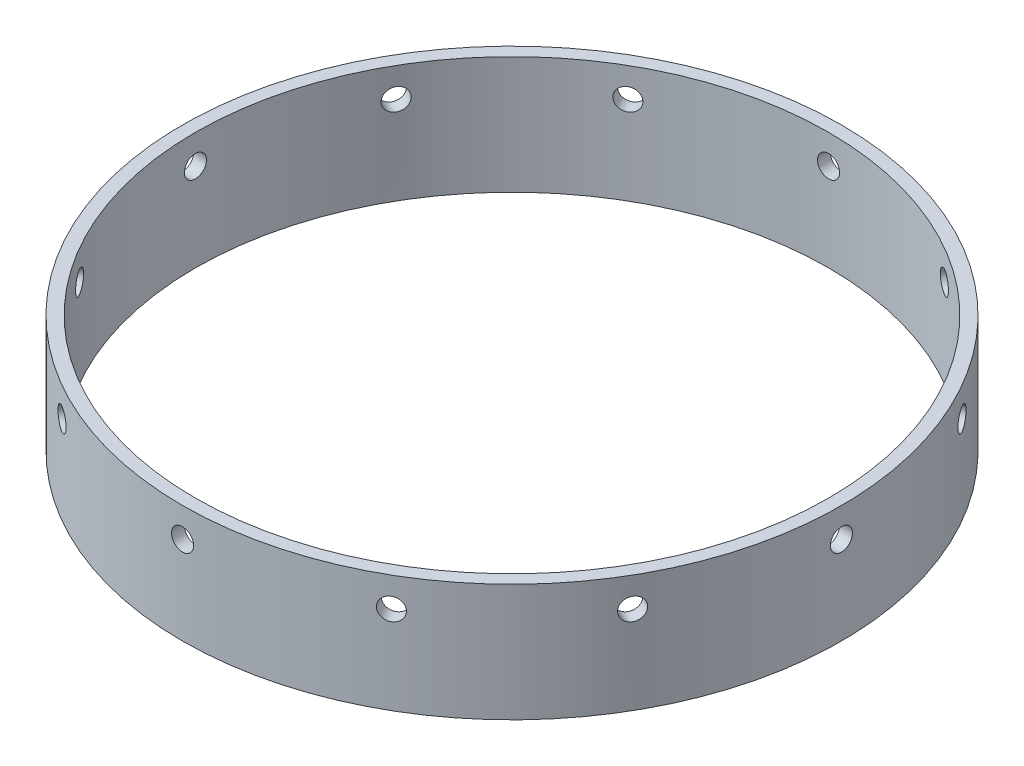
from build123d import *

# Parameters (mm, degrees)
SKETCH_1_R               = 44.9
SKETCH_1_R_2             = 2.5
SKETCH_1_R_3             = 18.4
EXTRUDE_1_DEPTH          = 16
SKETCH_2_R               = 4
CUT_EXTRUDE_1_DEPTH      = 3
SKETCH_4_R               = 4.5
CUT_EXTRUDE_2_DEPTH      = 5.1
SKETCH_5_R               = 1.5
CUT_EXTRUDE_3_DEPTH      = 10
PATTERN_CIRCULAR_1_COUNT = 12
FILLET_1_R               = 0.5
SKETCH1_R                = 43.15
CUT_EXTRUDE1_DEPTH       = 66.482975056


with BuildPart() as part:
    # 草图1 → 凸台-拉伸1 (new body)
    with BuildSketch(Plane(origin=(0, 0, 0), x_dir=(1, 0, 0), z_dir=(0, 1, 0))):
        with Locations(Location((0, 0, 0), (0, 0, 270))):
            Circle(SKETCH_1_R)
        with Locations(Location((-24.6, 0, 0), (0, 0, 270))):
            Circle(SKETCH_1_R_2, mode=Mode.SUBTRACT)
        with Locations(Location((-12.3, 21.304224933, 0), (0, 0, 270))):
            Circle(SKETCH_1_R_2, mode=Mode.SUBTRACT)
        with Locations(Location((12.3, 21.304224933, 0), (0, 0, 270))):
            Circle(SKETCH_1_R_2, mode=Mode.SUBTRACT)
        with Locations(Location((24.6, 0, 0), (0, 0, 270))):
            Circle(SKETCH_1_R_2, mode=Mode.SUBTRACT)
        with Locations(Location((12.3, -21.304224933, 0), (0, 0, 270))):
            Circle(SKETCH_1_R_2, mode=Mode.SUBTRACT)
        with Locations(Location((-12.3, -21.304224933, 0), (0, 0, 270))):
            Circle(SKETCH_1_R_2, mode=Mode.SUBTRACT)
        with Locations(Location((0, 0, 0), (0, 0, 270))):
            Circle(SKETCH_1_R_3, mode=Mode.SUBTRACT)
    extrude(amount=EXTRUDE_1_DEPTH)

    # 草图2 → 切除-拉伸1 (cut)
    with BuildSketch(Plane.XZ):
        with Locations(Location((-21.304224933, -12.3, 0), (0, 0, 270))):
            Circle(SKETCH_2_R)
        with Locations(Location((0, 24.6, 0), (0, 0, 270))):
            Circle(SKETCH_2_R)
        with Locations(Location((21.304224933, -12.3, 0), (0, 0, 270))):
            Circle(SKETCH_2_R)
    extrude(amount=-CUT_EXTRUDE_1_DEPTH, mode=Mode.SUBTRACT)

    # 草图4 → 切除-拉伸2 (cut)
    with BuildSketch(Plane(origin=(0, 16, 0), x_dir=(1, 0, 0), z_dir=(0, 1, 0))):
        with Locations(Location((-24.6, 0, 0), (0, 0, 270))):
            Circle(SKETCH_4_R)
        with Locations(Location((-12.3, 21.304224933, 0), (0, 0, 270))):
            Circle(SKETCH_4_R)
        with Locations(Location((12.3, 21.304224933, 0), (0, 0, 270))):
            Circle(SKETCH_4_R)
        with Locations(Location((24.6, 0, 0), (0, 0, 270))):
            Circle(SKETCH_4_R)
        with Locations(Location((12.3, -21.304224933, 0), (0, 0, 270))):
            Circle(SKETCH_4_R)
        with Locations(Location((-12.3, -21.304224933, 0), (0, 0, 270))):
            Circle(SKETCH_4_R)
    extrude(amount=-CUT_EXTRUDE_2_DEPTH, mode=Mode.SUBTRACT)

    # 草图5 → 切除-拉伸3 (cut)
    with BuildSketch(Plane(origin=(45, 0, 0), x_dir=(0, 0, -1), z_dir=(1, 0, 0))):
        with Locations((0, 12)):
            Circle(SKETCH_5_R)
    cut_extrude_3 = extrude(amount=-CUT_EXTRUDE_3_DEPTH, mode=Mode.SUBTRACT)

    # 阵列(圆周)1: 切除-拉伸3 ×12 about axis
    pattern_circular_1_axis = Axis((0, 0, 0), (0, 1, 0))
    for i in range(1, PATTERN_CIRCULAR_1_COUNT):
        add(cut_extrude_3.rotate(pattern_circular_1_axis, i * 360 / PATTERN_CIRCULAR_1_COUNT), mode=Mode.SUBTRACT)

    # 圆角1
    fillet_1_edges = [part.edges().sort_by_distance(p)[0] for p in [
        (0, 16, -18.4),
    ]]
    fillet(fillet_1_edges, radius=FILLET_1_R)

    # Sketch1 → Cut-Extrude1 (cut, through all)
    with BuildSketch(Plane(origin=(0, 16, 0), x_dir=(1, 0, 0), z_dir=(0, 1, 0))):
        with Locations(Location((0, 0, 0), (0, 0, 270))):
            Circle(SKETCH1_R)
    extrude(amount=-CUT_EXTRUDE1_DEPTH, mode=Mode.SUBTRACT)


solid = part.part
